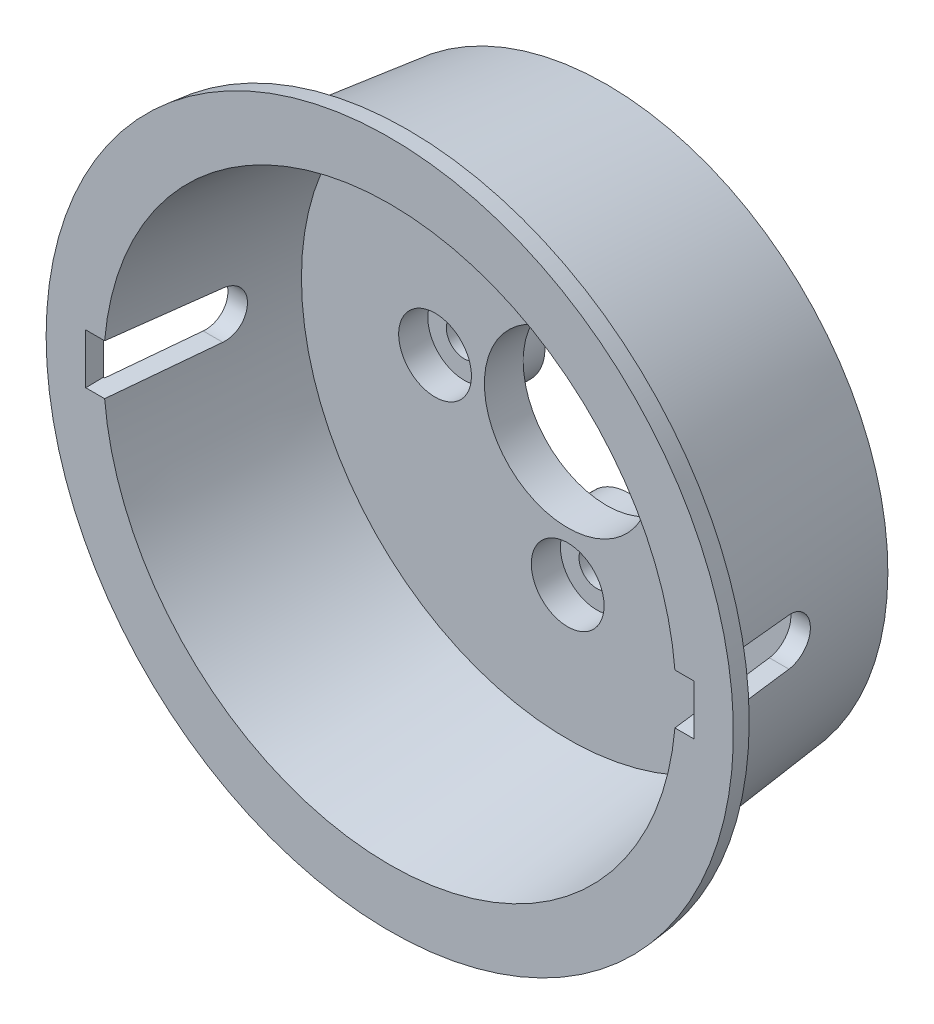
from build123d import *

# Parameters (mm, degrees)
ESQUISSE3_R                  = 3
ESQUISSE3_R_2                = 1.8
BOSS_EXTRU_1_DEPTH           = 1.4
ESQUISSE6_R                  = 2.25
ENL_V_MAT_EXTRU_2_DEPTH      = 1.8
ESQUISSE4_R                  = 5.15
ESQUISSE4_R_2                = 1.1
ENL_V_MAT_EXTRU_1_DEPTH      = 33.001953065
ENL_V_MAT_EXTRU_3_DEPTH      = 18.8
ENL_V_MAT_EXTRU_3_DEPTH_BACK = 18.8


with BuildPart() as part:
    # Esquisse2 → Révolution1 (revolve)
    with BuildSketch(Plane(origin=(0, 0, 0), x_dir=(0, 0, -1), z_dir=(1, 0, 0))):
        Polygon((0, 0), (0, 17.4), (-12.3, 18.783814786), (-12.3, 21.126244206), (-13.4, 21.25), (-13.4, 17.7), (-2.4, 16.462442061), (-2.4, 0), align=None)
    revolve(axis=Axis((0, 0, 0), (0, 0, 1)))

    # Esquisse3 → Boss.-Extru.1 (add)
    # profile 1 of 4: a face of its own
    with BuildSketch(Plane(origin=(0, 0, 0), x_dir=(-1, 0, 0), z_dir=(0, 0, -1))):
        with Locations((0, -8.199894223)):
            Circle(ESQUISSE3_R)
        with Locations((0, -8.199894223)):
            Circle(ESQUISSE3_R_2, mode=Mode.SUBTRACT)
    # profile 2 of 4: a face of its own
    with BuildSketch(Plane(origin=(0, 0, 0), x_dir=(-1, 0, 0), z_dir=(0, 0, -1))):
        with Locations((-8.199894223, 0)):
            Circle(ESQUISSE3_R)
        with Locations((-8.199894223, 0)):
            Circle(ESQUISSE3_R_2, mode=Mode.SUBTRACT)
    # profile 3 of 4: a face of its own
    with BuildSketch(Plane(origin=(0, 0, 0), x_dir=(-1, 0, 0), z_dir=(0, 0, -1))):
        with Locations((0, 8.199894223)):
            Circle(ESQUISSE3_R)
        with Locations((0, 8.199894223)):
            Circle(ESQUISSE3_R_2, mode=Mode.SUBTRACT)
    # profile 4 of 4: a face of its own
    with BuildSketch(Plane(origin=(0, 0, 0), x_dir=(-1, 0, 0), z_dir=(0, 0, -1))):
        with Locations((8.199894223, 0)):
            Circle(ESQUISSE3_R)
        with Locations((8.199894223, 0)):
            Circle(ESQUISSE3_R_2, mode=Mode.SUBTRACT)
    extrude(amount=BOSS_EXTRU_1_DEPTH)

    # Esquisse6 → Enlèv. mat.-Extru.2 (cut)
    with BuildSketch(Plane.XY.offset(2.4)):
        with Locations((0, 8.199894223)):
            Circle(ESQUISSE6_R)
        with Locations((8.199894223, 0)):
            Circle(ESQUISSE6_R)
        with Locations((0, -8.199894223)):
            Circle(ESQUISSE6_R)
        with Locations((-8.199894223, 0)):
            Circle(ESQUISSE6_R)
    extrude(amount=-ENL_V_MAT_EXTRU_2_DEPTH, mode=Mode.SUBTRACT)

    # Esquisse4 → Enlèv. mat.-Extru.1 (cut, through all)
    with BuildSketch(Plane.XY.offset(2.4)):
        Circle(ESQUISSE4_R)
        with Locations((0, 8.199894223)):
            Circle(ESQUISSE4_R_2)
        with Locations((8.199894223, 0)):
            Circle(ESQUISSE4_R_2)
        with Locations((0, -8.199894223)):
            Circle(ESQUISSE4_R_2)
        with Locations((-8.199894223, 0)):
            Circle(ESQUISSE4_R_2)
    extrude(amount=-ENL_V_MAT_EXTRU_1_DEPTH, mode=Mode.SUBTRACT)

    # Esquisse7 → Enlèv. mat.-Extru.3 (cut, two sides: drawn at the far end of the back side and taken through both)
    with BuildSketch(Plane(origin=(0, 0, 0), x_dir=(0, 0, -1), z_dir=(1, 0, 0)).offset(-ENL_V_MAT_EXTRU_3_DEPTH_BACK)):
        with BuildLine():
            Line((-13.4, 1.55), (-6.827902443, 1.44983161))
            ThreePointArc((-6.827902443, 1.44983161), (-5.4, 0), (-6.827902443, -1.44983161))
            Line((-6.827902443, -1.44983161), (-13.4, -1.55))
            Line((-13.4, -1.55), (-13.4, 1.55))
        make_face()
    extrude(amount=ENL_V_MAT_EXTRU_3_DEPTH + ENL_V_MAT_EXTRU_3_DEPTH_BACK, mode=Mode.SUBTRACT)


solid = part.part
